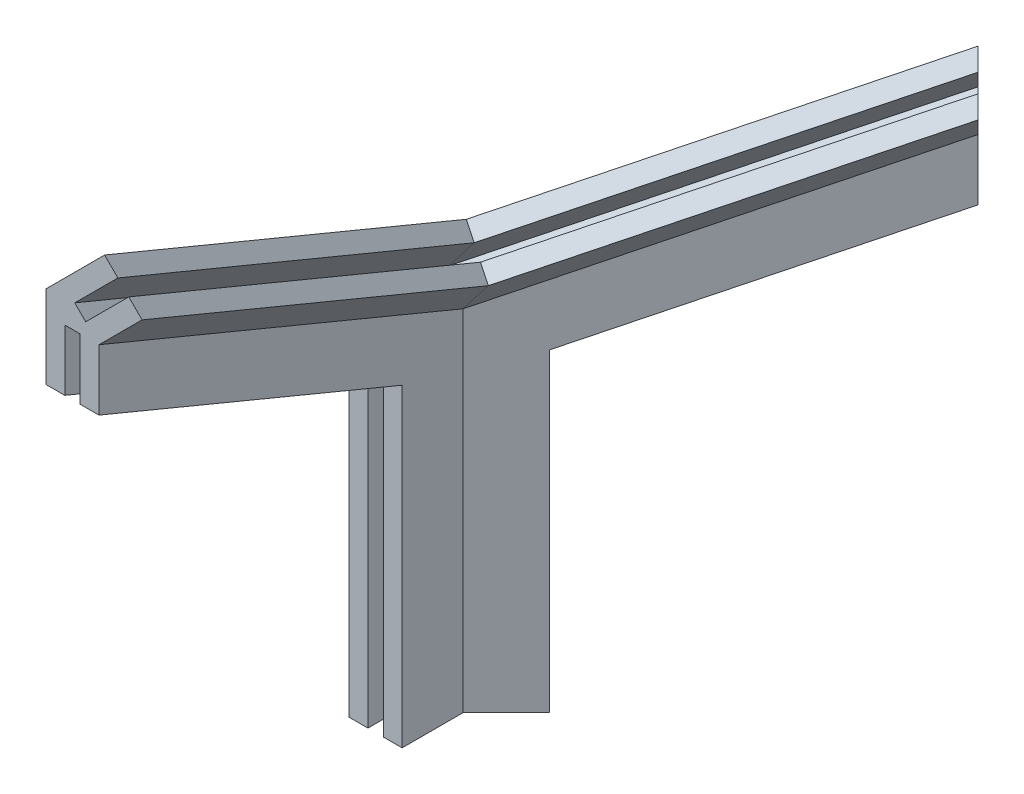
from build123d import *

# Parameters (mm, degrees)
BOSS_EXTRUDE1_DEPTH = 80
CUT_EXTRUDE2_DEPTH  = 82.280481137
SKETCH6_W           = 4
SKETCH6_H           = 13
BOSS_EXTRUDE6_DEPTH = 70
BOSS_EXTRUDE7_REACH = 148.386
BOSS_EXTRUDE8_REACH = 152.425


with BuildPart() as part:
    # Sketch1 → Boss-Extrude1 (new body)
    with BuildSketch(Plane(origin=(0, 0, 0), x_dir=(1, 0, 0), z_dir=(0, 1, 0))):
        Polygon((3.622068507, 4.197822071), (3.622068507, -8.802177929), (-0.377931493, -8.802177929), (-0.377931493, 4.197822071), (-3.677931493, 4.197822071), (-3.677931493, -8.802177929), (-7.677931493, -8.802177929), (-7.677931493, 8.878435326), align=None)
    extrude(amount=BOSS_EXTRUDE1_DEPTH)

    # Sketch2 → Cut-Extrude2 (cut, through all)
    with BuildSketch(Plane.ZY.offset(7.677931493)):
        Polygon((8.802177929, 80), (-8.878435326, 80), (-8.878435326, 72.672231838), align=None)
    extrude(amount=-CUT_EXTRUDE2_DEPTH, mode=Mode.SUBTRACT)

    # Sketch6 → Boss-Extrude6 (add, along a direction that is not the sketch's normal)
    with BuildSketch(Plane.XY.offset(8.802177929)):
        with Locations((-5.677931493, 73.5)):
            Rectangle(SKETCH6_W, SKETCH6_H)
        with Locations((1.622068507, 73.5)):
            Rectangle(SKETCH6_W, SKETCH6_H)
    extrude(amount=BOSS_EXTRUDE6_DEPTH, dir=(0, 0.38287155344466034, 0.9238015877681054))

    # Boss-Extrude7: up to this plane
    boss_extrude7_end = Plane(origin=(3.622068507, 80, -4.197822071), z_dir=(-0.3826834323650841, 0, 0.9238795325112892))
    # Sketch7 → Boss-Extrude7 (add, up to the surface)
    with BuildSketch(Plane.XY.offset(73.468289073), mode=Mode.PRIVATE) as boss_extrude7_sk1:
        Polygon((3.622068507, 106.801008741), (-7.677931493, 106.801008741), (-7.677931493, 111.481621996), align=None)
    boss_extrude7_tool1 = split(extrude(boss_extrude7_sk1.sketch, amount=BOSS_EXTRUDE7_REACH, dir=(0, -0.382871553445, -0.923801587768), mode=Mode.PRIVATE), bisect_by=boss_extrude7_end, keep=Keep.BOTH, mode=Mode.PRIVATE)
    add(boss_extrude7_tool1.solids().sort_by_distance((-3.911265, 108.361213, 73.468289))[0])

    # Boss-Extrude8: up to this plane
    boss_extrude8_end = Plane(origin=(3.622068507, 80, -4.197822071), z_dir=(-0.3826834323650841, 0, 0.9238795325112892))
    # Sketch14 → Boss-Extrude8 (add, up to the surface)
    with BuildSketch(Plane.XY.offset(73.468289073), mode=Mode.PRIVATE) as boss_extrude8_sk1:
        Polygon((7.65257716, 121.155276399), (4.824150035, 123.983703524), (-7.677931493, 111.481621996), (3.622068507, 106.801008741), (12.814456663, 115.993396897), (9.986029538, 118.821824021), (0.793641383, 109.629435866), (-1.539810995, 111.962888244), align=None)
    boss_extrude8_tool1 = split(extrude(boss_extrude8_sk1.sketch, amount=BOSS_EXTRUDE8_REACH, dir=(0, -0.382871553445, -0.923801587768), mode=Mode.PRIVATE), bisect_by=boss_extrude8_end, keep=Keep.BOTH, mode=Mode.PRIVATE)
    add(boss_extrude8_tool1.solids().sort_by_distance((6.049263, 122.380389, 73.468289))[0])

    # Mirror9: part across plane


with BuildPart() as part_1:
    add(part.part)
    add(part.part.mirror(Plane(origin=(2.014593878, 0, -4.863659863), x_dir=(0.9238795325112891, 0, 0.3826834323650842), z_dir=(0.3826834323650841, 0, -0.9238795325112892))))


solid = part_1.part
